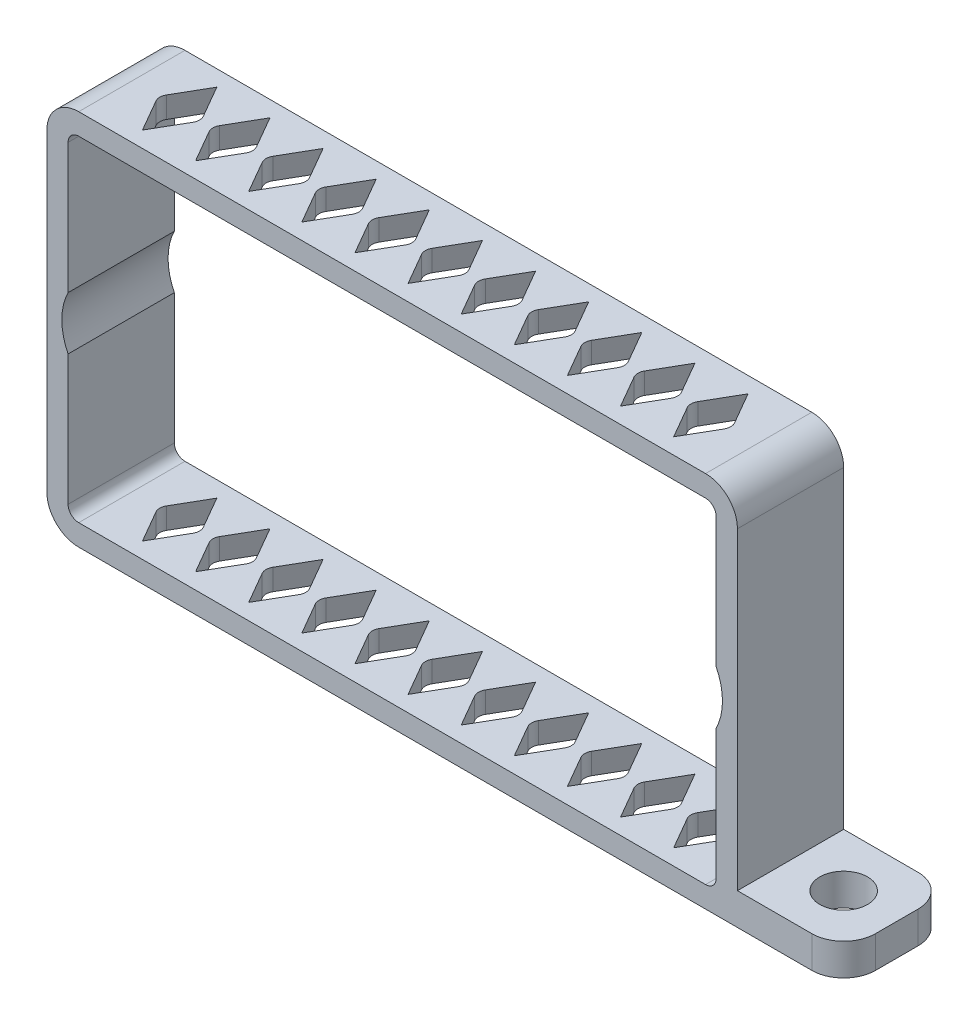
from build123d import *

# Parameters (mm, degrees)
BOSS_EXTRUDE1_DEPTH = 5
SKETCH2_R           = 2.25
CUT_EXTRUDE1_DEPTH  = 54.735463151
FILLET1_R           = 3
CUT_EXTRUDE2_DEPTH  = 56.601258979
LPATTERN1_COUNT     = 6
LPATTERN1_PITCH     = 5
LPATTERN1_COL_COUNT = 6
LPATTERN1_COL_PITCH = 5


with BuildPart() as part:
    # Sketch1 → Boss-Extrude1 (new, symmetric)
    with BuildSketch(Plane.XY):
        with BuildLine():
            Line((-32.5, -14.75), (-32.5, 14.75))
            ThreePointArc((-32.5, 14.75), (-31.621320344, 16.871320344), (-29.5, 17.75))
            Line((-29.5, 17.75), (29.5, 17.75))
            ThreePointArc((29.5, 17.75), (31.621320344, 16.871320344), (32.5, 14.75))
            Line((32.5, 14.75), (32.5, -14.75))
            Line((32.5, -14.75), (42.5, -14.75))
            Line((42.5, -14.75), (42.5, -17.75))
            Line((42.5, -17.75), (29.5, -17.75))
            Line((29.5, -17.75), (-29.5, -17.75))
            ThreePointArc((-29.5, -17.75), (-31.621320344, -16.871320344), (-32.5, -14.75))
        make_face()
        with BuildLine():
            Line((-29.5, -15.75), (29.5, -15.75))
            ThreePointArc((29.5, -15.75), (30.207106781, -15.457106781), (30.5, -14.75))
            Line((30.5, -14.75), (30.5, -2.5))
            ThreePointArc((30.5, -2.5), (31.090169944, 0), (30.5, 2.5))
            Line((30.5, 2.5), (30.5, 14.75))
            ThreePointArc((30.5, 14.75), (30.207106781, 15.457106781), (29.5, 15.75))
            Line((29.5, 15.75), (-29.5, 15.75))
            ThreePointArc((-29.5, 15.75), (-30.207106781, 15.457106781), (-30.5, 14.75))
            Line((-30.5, 14.75), (-30.5, 2.5))
            ThreePointArc((-30.5, 2.5), (-31.090169944, 0), (-30.5, -2.5))
            Line((-30.5, -2.5), (-30.5, -14.75))
            ThreePointArc((-30.5, -14.75), (-30.207106781, -15.457106781), (-29.5, -15.75))
        make_face(mode=Mode.SUBTRACT)
    extrude(amount=BOSS_EXTRUDE1_DEPTH, both=True)

    # Sketch2 → Cut-Extrude1 (cut, through all)
    with BuildSketch(Plane(origin=(0, -14.75, 0), x_dir=(1, 0, 0), z_dir=(0, 1, 0))):
        with Locations(Location((37.5, 0, 0), (0, 0, 180))):
            Circle(SKETCH2_R)
    extrude(amount=-CUT_EXTRUDE1_DEPTH, mode=Mode.SUBTRACT)

    # Fillet1
    fillet1_edges = [part.edges().sort_by_distance(p)[0] for p in [
        (42.5, -16.25, -5),
        (42.5, -16.25, 5),
    ]]
    fillet(fillet1_edges, radius=FILLET1_R)

    # Sketch3 → Cut-Extrude2 (cut, through all)
    with BuildSketch(Plane.XZ.offset(17.75)):
        with BuildLine():
            Line((0, -3.5), (1.732050808, -0.5))
            ThreePointArc((1.732050808, -0.5), (1.866025404, 0), (1.732050808, 0.5))
            Line((1.732050808, 0.5), (0, 3.5))
            Line((0, 3.5), (-1.732050808, 0.5))
            ThreePointArc((-1.732050808, 0.5), (-1.866025404, 0), (-1.732050808, -0.5))
            Line((-1.732050808, -0.5), (0, -3.5))
        make_face()
    cut_extrude2 = extrude(amount=-CUT_EXTRUDE2_DEPTH, mode=Mode.SUBTRACT)

    # LPattern1: Cut-Extrude2 ×6
    with Locations(*[(-i * LPATTERN1_PITCH, 0, 0) for i in range(1, LPATTERN1_COUNT)]):
        add(cut_extrude2, mode=Mode.SUBTRACT)

    # LPattern1 col: Cut-Extrude2 ×6
    with Locations(*[(i * LPATTERN1_COL_PITCH, 0, 0) for i in range(1, LPATTERN1_COL_COUNT)]):
        add(cut_extrude2, mode=Mode.SUBTRACT)


solid = part.part
